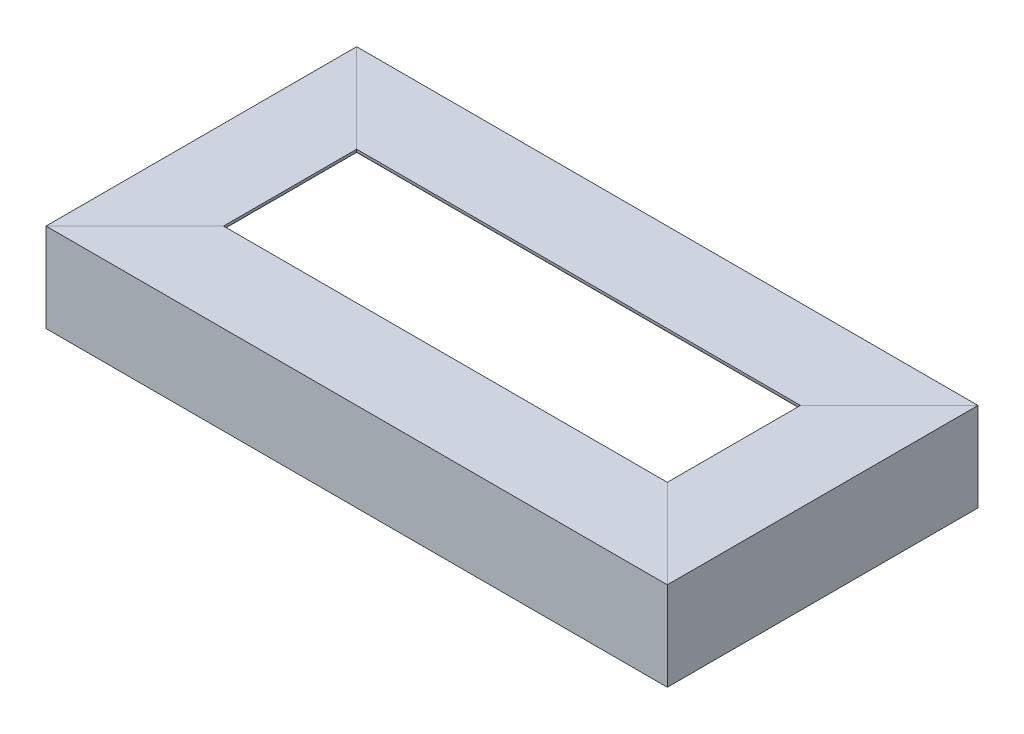
from build123d import *

# Parameters (mm, degrees)
IRON_V40X40X3_1_DEPTH      = 197.568542495
IRON_V40X40X3_1_DEPTH_BACK = 57.568542495
IRON_V40X40X3_1_2_DEPTH    = 395.13708499
IRON_V40X40X3_1_3_DEPTH    = 255.13708499
IRON_V40X40X3_1_4_DEPTH    = 395.13708499


with BuildPart() as part:
    # Sketch1 → Iron V40X40X3(1) (new, two sides: drawn at the far end of the back side and taken through both)
    with BuildSketch(Plane(origin=(-140, 0, 70), x_dir=(1, 0, 0), z_dir=(0, 0, -1)).offset(-IRON_V40X40X3_1_DEPTH_BACK)):
        with BuildLine():
            Line((0, 0), (0, 40))
            ThreePointArc((0, 40), (2.121320344, 39.121320344), (3, 37))
            Line((3, 37), (3, 6.5))
            ThreePointArc((3, 6.5), (4.025126266, 4.025126266), (6.5, 3))
            Line((6.5, 3), (37, 3))
            ThreePointArc((37, 3), (39.121320344, 2.121320344), (40, 0))
            Line((40, 0), (0, 0))
        make_face()
    extrude(amount=IRON_V40X40X3_1_DEPTH + IRON_V40X40X3_1_DEPTH_BACK)

    # Iron V40X40X3(1) mitre 1
    split(bisect_by=Plane(origin=(-140, 0, 70), x_dir=(0, -1, 0), z_dir=(-0.707106781, 0, -0.707106781)), keep=Keep.TOP)

    # Iron V40X40X3(1) mitre 2
    split(bisect_by=Plane(origin=(-140, 0, -70), x_dir=(0, -1, 0), z_dir=(-0.707106781, 0, 0.707106781)), keep=Keep.TOP)


with BuildPart() as body_2:
    # Sketch1 on segment 2 (carried to segment 2) → Iron V40X40X3_1 2 (new body)
    with BuildSketch(Plane(origin=(-197.568542495, 0, -70), x_dir=(0, 0, 1), z_dir=(1, 0, 0))):
        with BuildLine():
            Line((0, 0), (0, 40))
            ThreePointArc((0, 40), (2.121320344, 39.121320344), (3, 37))
            Line((3, 37), (3, 6.5))
            ThreePointArc((3, 6.5), (4.025126266, 4.025126266), (6.5, 3))
            Line((6.5, 3), (37, 3))
            ThreePointArc((37, 3), (39.121320344, 2.121320344), (40, 0))
            Line((40, 0), (0, 0))
        make_face()
    extrude(amount=IRON_V40X40X3_1_2_DEPTH)

    # Iron V40X40X3_1 2 mitre 1
    split(bisect_by=Plane(origin=(-140, 0, -70), x_dir=(0, 1, 0), z_dir=(0.707106781, 0, -0.707106781)), keep=Keep.TOP)

    # Iron V40X40X3_1 2 mitre 2
    split(bisect_by=Plane(origin=(140, 0, -70), x_dir=(0, -1, 0), z_dir=(-0.707106781, 0, -0.707106781)), keep=Keep.TOP)


with BuildPart() as body_3:
    # Sketch1 on segment 3 (carried to segment 3) → Iron V40X40X3_1 3 (new body)
    with BuildSketch(Plane(origin=(140, 0, -127.568542495), x_dir=(-1, 0, 0), z_dir=(0, 0, 1))):
        with BuildLine():
            Line((0, 0), (0, 40))
            ThreePointArc((0, 40), (2.121320344, 39.121320344), (3, 37))
            Line((3, 37), (3, 6.5))
            ThreePointArc((3, 6.5), (4.025126266, 4.025126266), (6.5, 3))
            Line((6.5, 3), (37, 3))
            ThreePointArc((37, 3), (39.121320344, 2.121320344), (40, 0))
            Line((40, 0), (0, 0))
        make_face()
    extrude(amount=IRON_V40X40X3_1_3_DEPTH)

    # Iron V40X40X3_1 3 mitre 1
    split(bisect_by=Plane(origin=(140, 0, 70), x_dir=(0, 1, 0), z_dir=(0.707106781, 0, -0.707106781)), keep=Keep.TOP)

    # Iron V40X40X3_1 3 mitre 2
    split(bisect_by=Plane(origin=(140, 0, -70), x_dir=(0, 1, 0), z_dir=(0.707106781, 0, 0.707106781)), keep=Keep.TOP)


with BuildPart() as body_4:
    # Sketch1 on segment 4 (carried to segment 4) → Iron V40X40X3_1 4 (new body)
    with BuildSketch(Plane(origin=(197.568542495, 0, 70), x_dir=(0, 0, -1), z_dir=(-1, 0, 0))):
        with BuildLine():
            Line((0, 0), (0, 40))
            ThreePointArc((0, 40), (2.121320344, 39.121320344), (3, 37))
            Line((3, 37), (3, 6.5))
            ThreePointArc((3, 6.5), (4.025126266, 4.025126266), (6.5, 3))
            Line((6.5, 3), (37, 3))
            ThreePointArc((37, 3), (39.121320344, 2.121320344), (40, 0))
            Line((40, 0), (0, 0))
        make_face()
    extrude(amount=IRON_V40X40X3_1_4_DEPTH)

    # Iron V40X40X3_1 4 mitre 1
    split(bisect_by=Plane(origin=(-140, 0, 70), x_dir=(0, 1, 0), z_dir=(0.707106781, 0, 0.707106781)), keep=Keep.TOP)

    # Iron V40X40X3_1 4 mitre 2
    split(bisect_by=Plane(origin=(140, 0, 70), x_dir=(0, -1, 0), z_dir=(-0.707106781, 0, 0.707106781)), keep=Keep.TOP)


solid = Compound([part.part, body_2.part, body_3.part, body_4.part])
